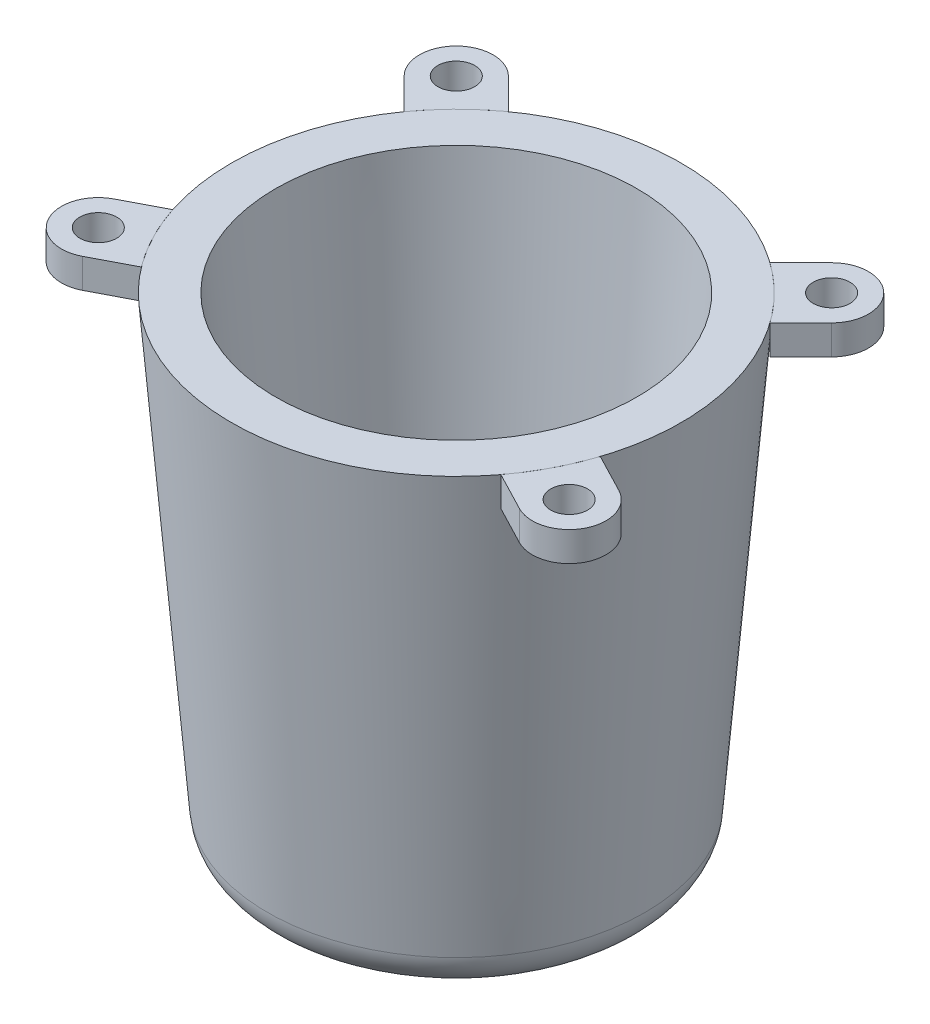
from build123d import *

# Parameters (mm, degrees)
CROQUIS3_R                = 1.25
SALIENTE_EXTRUIR1_DEPTH   = 2
SALIENTE_EXTRUIR1_2_DEPTH = 2
SALIENTE_EXTRUIR1_3_DEPTH = 2
SALIENTE_EXTRUIR1_4_DEPTH = 2


with BuildPart() as part:
    # Croquis2 → Revolución1 (revolve)
    with BuildSketch(Plane.XY, mode=Mode.PRIVATE) as revoluci_n1_sk:
        with BuildLine():
            Line((15.25, 0), (12.25, 0))
            Line((12.25, 0), (9.796635433, -30))
            Line((9.796635433, -30), (9.851324322, -32.5))
            ThreePointArc((9.851324322, -32.5), (11.841746831, -31.859993904), (12.796635433, -30))
            Line((12.796635433, -30), (15.25, 0))
        make_face()
    revolve(revoluci_n1_sk.sketch.rotate(Axis((0, 0, 0), (0, -1, 0)), 180), axis=Axis((0, 0, 0), (0, -1, 0)))


with BuildPart() as body_2:
    # Croquis3 → Saliente-Extruir1 (new body)
    with BuildSketch(Plane(origin=(0, 0, 0), x_dir=(1, 0, 0), z_dir=(0, 1, 0))):
        with BuildLine():
            ThreePointArc((14.495689014, 10.960155108), (14.495689014, 14.495689014), (10.960155108, 14.495689014))
            Line((10.960155108, 14.495689014), (8.869725703, 12.405259609))
            ThreePointArc((8.869725703, 12.405259609), (10.783378413, 10.783378413), (12.405259609, 8.869725703))
            Line((12.405259609, 8.869725703), (14.495689014, 10.960155108))
        make_face()
        with Locations(Location((12.727922061, 12.727922061, 0), (0, 0, 180))):
            Circle(CROQUIS3_R, mode=Mode.SUBTRACT)
    extrude(amount=-SALIENTE_EXTRUIR1_DEPTH)


with BuildPart() as body_3:
    # Croquis3 → Saliente-Extruir1 2 (new body)
    with BuildSketch(Plane(origin=(0, 0, 0), x_dir=(1, 0, 0), z_dir=(0, 1, 0))):
        with BuildLine():
            ThreePointArc((-12.405259609, 8.869725703), (-10.783378413, 10.783378413), (-8.869725703, 12.405259609))
            Line((-8.869725703, 12.405259609), (-10.960155108, 14.495689014))
            ThreePointArc((-10.960155108, 14.495689014), (-14.495689014, 14.495689014), (-14.495689014, 10.960155108))
            Line((-14.495689014, 10.960155108), (-12.405259609, 8.869725703))
        make_face()
        with Locations(Location((-12.727922061, 12.727922061, 0), (0, 0, 180))):
            Circle(CROQUIS3_R, mode=Mode.SUBTRACT)
    extrude(amount=-SALIENTE_EXTRUIR1_2_DEPTH)


with BuildPart() as body_4:
    # Croquis3 → Saliente-Extruir1 3 (new body)
    with BuildSketch(Plane(origin=(0, 0, 0), x_dir=(1, 0, 0), z_dir=(0, 1, 0))):
        with BuildLine():
            ThreePointArc((-12.18954126, -9.163928408), (-13.526915206, -7.041666352), (-14.498284326, -4.728874243))
            Line((-14.498284326, -4.728874243), (-17.12056653, -6.093947955))
            ThreePointArc((-17.12056653, -6.093947955), (-18.18372208, -9.465846571), (-14.811823464, -10.529002121))
            Line((-14.811823464, -10.529002121), (-12.18954126, -9.163928408))
        make_face()
        with Locations(Location((-15.966194997, -8.311475038, 0), (0, 0, 180))):
            Circle(CROQUIS3_R, mode=Mode.SUBTRACT)
    extrude(amount=-SALIENTE_EXTRUIR1_3_DEPTH)


with BuildPart() as body_5:
    # Croquis3 → Saliente-Extruir1 4 (new body)
    with BuildSketch(Plane(origin=(0, 0, 0), x_dir=(1, 0, 0), z_dir=(0, 1, 0))):
        with BuildLine():
            Line((17.12056653, -6.093947955), (14.498284326, -4.728874243))
            ThreePointArc((14.498284326, -4.728874243), (13.526915206, -7.041666352), (12.18954126, -9.163928408))
            Line((12.18954126, -9.163928408), (14.811823464, -10.529002121))
            ThreePointArc((14.811823464, -10.529002121), (18.18372208, -9.465846571), (17.12056653, -6.093947955))
        make_face()
        with Locations(Location((15.966194997, -8.311475038, 0), (0, 0, 180))):
            Circle(CROQUIS3_R, mode=Mode.SUBTRACT)
    extrude(amount=-SALIENTE_EXTRUIR1_4_DEPTH)


solid = Compound([part.part, body_2.part, body_3.part, body_4.part, body_5.part])
